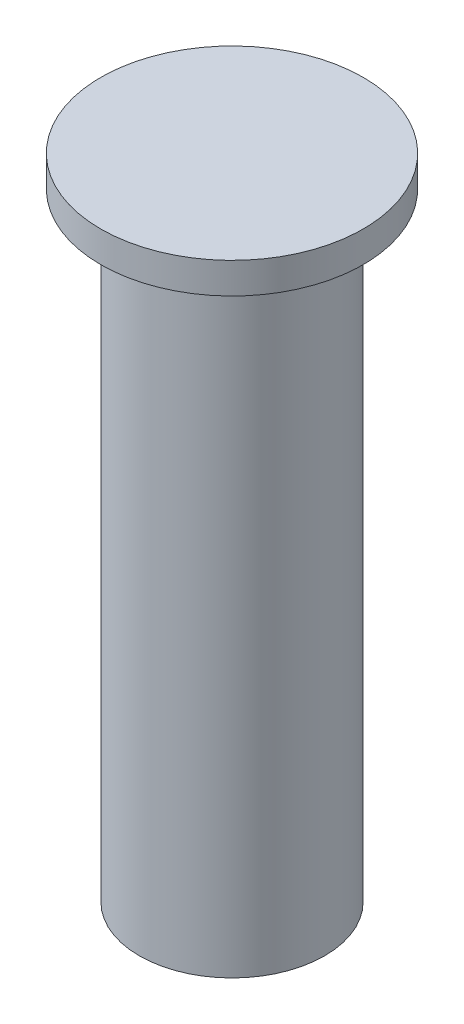
from build123d import *

# Parameters (mm, degrees)
MAIN_PROFILE_SKETCH_R     = 8.5
MAIN_EXTRUSION_DEPTH      = 2
DETAIL_EXTRUSION_2_DEPTH  = 31.5
DETAIL_EXTRUSION_3_DEPTH  = 0.5
DETAIL_PROFILE_4_SKETCH_R = 6
DETAIL_EXTRUSION_4_DEPTH  = 8


with BuildPart() as part:
    # Main Profile Sketch → Main Extrusion (new body)
    with BuildSketch(Plane(origin=(0, -123, 0), x_dir=(-1, 0, 0), z_dir=(0, -1, 0))):
        with Locations(Location((56.291651246, 0, 0), (0, 0, 90))):
            Circle(MAIN_PROFILE_SKETCH_R)
    extrude(amount=MAIN_EXTRUSION_DEPTH)

    # Detail Profile 2 Sketch → Detail Extrusion 2 (add)
    with BuildSketch(Plane(origin=(0, -125, 0), x_dir=(-1, 0, 0), z_dir=(0, -1, 0))):
        with BuildLine():
            ThreePointArc((51.384442087, -3.452433674), (62.011933361, 1.81062766), (50.291651246, 0))
            ThreePointArc((50.291651246, 0), (50.571369131, -1.81062766), (51.384442087, -3.452433674))
        make_face()
    extrude(amount=DETAIL_EXTRUSION_2_DEPTH)

    # Detail Profile 3 Sketch → Detail Extrusion 3 (add)
    with BuildSketch(Plane(origin=(0, -156.5, 0), x_dir=(-1, 0, 0), z_dir=(0, -1, 0))):
        with BuildLine():
            ThreePointArc((51.384442087, -3.452433674), (62.011933361, 1.81062766), (50.291651246, 0))
            ThreePointArc((50.291651246, 0), (50.571369131, -1.81062766), (51.384442087, -3.452433674))
        make_face()
    extrude(amount=DETAIL_EXTRUSION_3_DEPTH)

    # Detail Profile 4 Sketch → Detail Extrusion 4 (add)
    with BuildSketch(Plane(origin=(0, -157, 0), x_dir=(-1, 0, 0), z_dir=(0, -1, 0))):
        with Locations(Location((56.291651246, 0, 0), (0, 0, 90))):
            Circle(DETAIL_PROFILE_4_SKETCH_R)
    extrude(amount=DETAIL_EXTRUSION_4_DEPTH)


solid = part.part
